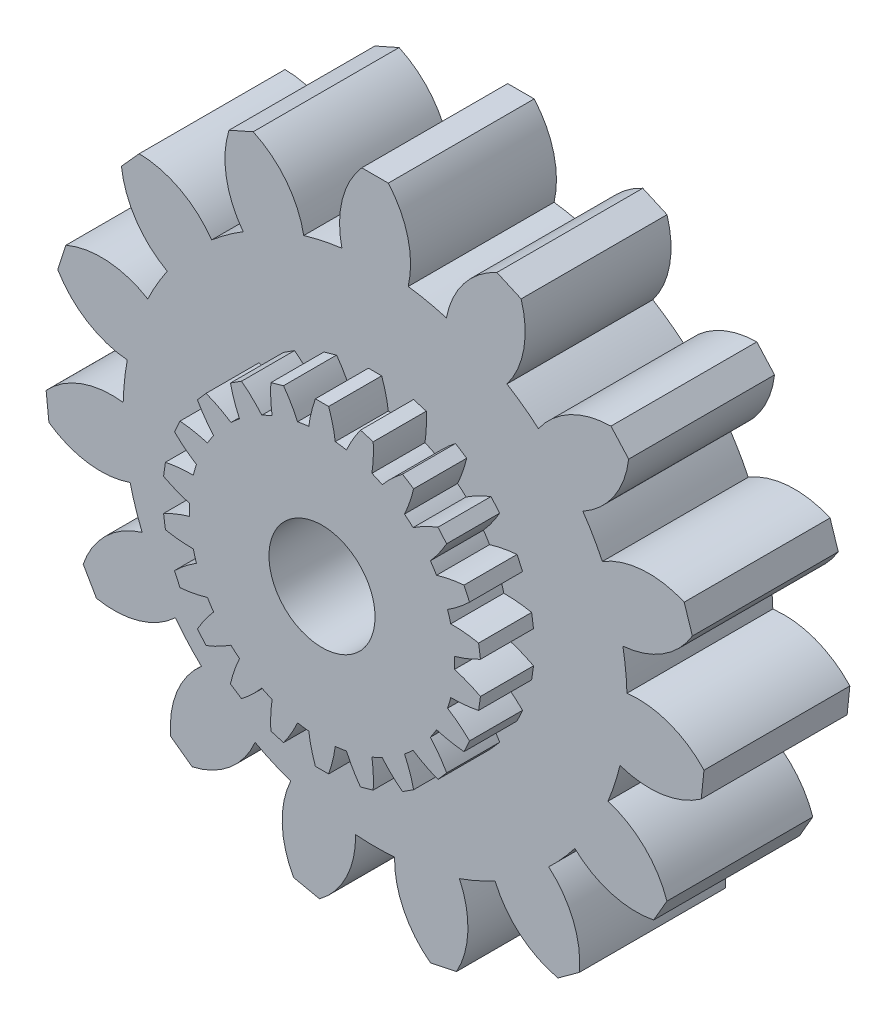
from build123d import *

# Parameters (mm, degrees)
SKETCH_2_R          = 9.5
EXTRUDE_1_DEPTH     = 5.5
EXTRUDE_START       = -5.5
EXTRUDE_2_DEPTH     = 5.5
SKETCH_4_R          = 5
EXTRUDE_3_DEPTH     = 2
EXTRUDE_4_REACH     = 21.085
SKETCH_6_R          = 2
CUT_EXTRUDE_1_DEPTH = 20.085143718
CUT_EXTRUDE_START   = -7.5
CUT_EXTRUDE_2_DEPTH = 2
SKETCH_8_R          = 5
CUT_EXTRUDE_3_DEPTH = 2


with BuildPart() as part:
    # 草图2 → 凸台-拉伸1 (new body)
    with BuildSketch(Plane.XY):
        Circle(SKETCH_2_R)
    extrude(amount=EXTRUDE_1_DEPTH)

    # 草图3 → 凸台-拉伸2 (add)
    with BuildSketch(Plane.XY.offset(5.5).offset(EXTRUDE_START)):
        with BuildLine():
            Line((5.507385989, 11.140494791), (4.593840531, 11.547231434))
            ThreePointArc((4.593840531, 11.547231434), (3.346426162, 10.560008077), (2.688471508, 9.111647543))
            ThreePointArc((2.688471508, 9.111647543), (3.863998109, 8.678681848), (4.972335153, 8.094805935))
            ThreePointArc((4.972335153, 8.094805935), (5.608419193, 9.552903894), (5.507385989, 11.140494791))
        make_face()
        with BuildLine():
            Line((0.5, 12.417404101), (-0.5, 12.417404101))
            ThreePointArc((-0.5, 12.417404101), (-1.238029817, 11.008161555), (-1.25, 9.417404101))
            ThreePointArc((-1.25, 9.417404101), (0, 9.5), (1.25, 9.417404101))
            ThreePointArc((1.25, 9.417404101), (1.238029817, 11.008161555), (0.5, 12.417404101))
        make_face()
        with BuildLine():
            Line((9.562494907, 7.937292723), (8.8933643, 8.680437548))
            ThreePointArc((8.8933643, 8.680437548), (7.352254656, 8.285933268), (6.162081869, 7.230404348))
            ThreePointArc((6.162081869, 7.230404348), (7.059875842, 6.35674076), (7.834908385, 5.372542285))
            ThreePointArc((7.834908385, 5.372542285), (9.00906194, 6.445862364), (9.562494907, 7.937292723))
        make_face()
        with BuildLine():
            Line((11.964161583, 3.361660635), (11.655144588, 4.312717151))
            ThreePointArc((11.655144588, 4.312717151), (10.086811526, 4.579145322), (8.570212294, 4.098958555))
            ThreePointArc((8.570212294, 4.098958555), (9.035036905, 2.935661447), (9.34275478, 1.721317265))
            ThreePointArc((9.34275478, 1.721317265), (10.851956032, 2.224272673), (11.964161583, 3.361660635))
        make_face()
        with BuildLine():
            Line((12.29711603, -1.795233116), (12.401644494, -0.800711221))
            ThreePointArc((12.401644494, -0.800711221), (11.077267049, 0.080581549), (9.496475155, 0.258765591))
            ThreePointArc((9.496475155, 0.258765591), (9.447958006, -0.993020401), (9.235153997, -2.227539148))
            ThreePointArc((9.235153997, -2.227539148), (10.81844834, -2.381913971), (12.29711603, -1.795233116))
        make_face()
        with BuildLine():
            Line((10.5037874, -6.641714752), (11.0037874, -5.775689349))
            ThreePointArc((11.0037874, -5.775689349), (10.152362464, -4.431915506), (8.780711189, -3.626170296))
            ThreePointArc((8.780711189, -3.626170296), (8.227241336, -4.75), (7.530711189, -5.791233805))
            ThreePointArc((7.530711189, -5.791233805), (8.914332647, -6.576246049), (10.5037874, -6.641714752))
        make_face()
        with BuildLine():
            Line((6.894258505, -10.33978357), (7.703275499, -9.751998318))
            ThreePointArc((7.703275499, -9.751998318), (7.472022178, -8.178094107), (6.546682488, -6.884108395))
            ThreePointArc((6.546682488, -6.884108395), (5.583959897, -7.685661447), (4.524140002, -8.353571526))
            ThreePointArc((4.524140002, -8.353571526), (5.468847856, -9.633485443), (6.894258505, -10.33978357))
        make_face()
        with BuildLine():
            Line((2.092649682, -12.250009874), (3.070797283, -12.042098183))
            ThreePointArc((3.070797283, -12.042098183), (3.499701377, -10.510205941), (3.180672911, -8.951721613))
            ThreePointArc((3.180672911, -8.951721613), (1.975161063, -9.292402207), (0.735303909, -9.47150084))
            ThreePointArc((0.735303909, -9.47150084), (1.077749587, -11.025007686), (2.092649682, -12.250009874))
        make_face()
        with BuildLine():
            Line((-3.070797283, -12.042098183), (-2.092649682, -12.250009874))
            ThreePointArc((-2.092649682, -12.250009874), (-1.077749587, -11.025007686), (-0.735303909, -9.47150084))
            ThreePointArc((-0.735303909, -9.47150084), (-1.975161063, -9.292402207), (-3.180672911, -8.951721613))
            ThreePointArc((-3.180672911, -8.951721613), (-3.499701377, -10.510205941), (-3.070797283, -12.042098183))
        make_face()
        with BuildLine():
            Line((-7.703275499, -9.751998318), (-6.894258505, -10.33978357))
            ThreePointArc((-6.894258505, -10.33978357), (-5.468847856, -9.633485443), (-4.524140002, -8.353571526))
            ThreePointArc((-4.524140002, -8.353571526), (-5.583959897, -7.685661447), (-6.546682488, -6.884108395))
            ThreePointArc((-6.546682488, -6.884108395), (-7.472022178, -8.178094107), (-7.703275499, -9.751998318))
        make_face()
        with BuildLine():
            Line((-11.0037874, -5.775689349), (-10.5037874, -6.641714752))
            ThreePointArc((-10.5037874, -6.641714752), (-8.914332647, -6.576246049), (-7.530711189, -5.791233805))
            ThreePointArc((-7.530711189, -5.791233805), (-8.227241336, -4.75), (-8.780711189, -3.626170296))
            ThreePointArc((-8.780711189, -3.626170296), (-10.152362464, -4.431915506), (-11.0037874, -5.775689349))
        make_face()
        with BuildLine():
            Line((-12.401644494, -0.800711221), (-12.29711603, -1.795233116))
            ThreePointArc((-12.29711603, -1.795233116), (-10.81844834, -2.381913971), (-9.235153997, -2.227539148))
            ThreePointArc((-9.235153997, -2.227539148), (-9.447958006, -0.993020401), (-9.496475155, 0.258765591))
            ThreePointArc((-9.496475155, 0.258765591), (-11.077267049, 0.080581549), (-12.401644494, -0.800711221))
        make_face()
        with BuildLine():
            Line((-11.655144588, 4.312717151), (-11.964161583, 3.361660635))
            ThreePointArc((-11.964161583, 3.361660635), (-10.851956032, 2.224272673), (-9.34275478, 1.721317265))
            ThreePointArc((-9.34275478, 1.721317265), (-9.035036905, 2.935661447), (-8.570212294, 4.098958555))
            ThreePointArc((-8.570212294, 4.098958555), (-10.086811526, 4.579145322), (-11.655144588, 4.312717151))
        make_face()
        with BuildLine():
            Line((-8.8933643, 8.680437548), (-9.562494907, 7.937292723))
            ThreePointArc((-9.562494907, 7.937292723), (-9.00906194, 6.445862364), (-7.834908385, 5.372542285))
            ThreePointArc((-7.834908385, 5.372542285), (-7.059875842, 6.35674076), (-6.162081869, 7.230404348))
            ThreePointArc((-6.162081869, 7.230404348), (-7.352254656, 8.285933268), (-8.8933643, 8.680437548))
        make_face()
        with BuildLine():
            Line((-4.593840531, 11.547231434), (-5.507385989, 11.140494791))
            ThreePointArc((-5.507385989, 11.140494791), (-5.608419193, 9.552903894), (-4.972335153, 8.094805935))
            ThreePointArc((-4.972335153, 8.094805935), (-3.863998109, 8.678681848), (-2.688471508, 9.111647543))
            ThreePointArc((-2.688471508, 9.111647543), (-3.346426162, 10.560008077), (-4.593840531, 11.547231434))
        make_face()
    extrude(amount=EXTRUDE_2_DEPTH)

    # 草图4 → 凸台-拉伸3 (add)
    with BuildSketch(Plane.XY.offset(5.5)):
        Circle(SKETCH_4_R)
    extrude(amount=EXTRUDE_3_DEPTH)

    # 草图5 → 凸台-拉伸4 (add, up to next)
    with BuildSketch(Plane.XY.offset(7.5), mode=Mode.PRIVATE) as extrude_4_sk1:
        with BuildLine():
            Line((1.930268584, 5.686524702), (1.450522098, 5.827390981))
            ThreePointArc((1.450522098, 5.827390981), (1.16259648, 5.384496579), (0.921855287, 4.914283552))
            ThreePointArc((0.921855287, 4.914283552), (1.408662784, 4.797464868), (1.88134826, 4.632550995))
            ThreePointArc((1.88134826, 4.632550995), (1.933040236, 5.158273881), (1.930268584, 5.686524702))
        make_face()
    extrude_4_tool1 = extrude(extrude_4_sk1.sketch, amount=-EXTRUDE_4_REACH, mode=Mode.PRIVATE) - part.part
    # 草图5 → 凸台-拉伸4 (add, up to next)
    with BuildSketch(Plane.XY.offset(7.5), mode=Mode.PRIVATE) as extrude_4_sk2:
        with BuildLine():
            Line((3.454158288, 4.912360993), (3.033531522, 5.182681401))
            ThreePointArc((3.033531522, 5.182681401), (2.632491142, 4.838845355), (2.26902734, 4.455503892))
            ThreePointArc((2.26902734, 4.455503892), (2.703204087, 4.206267664), (3.110280873, 3.914863074))
            ThreePointArc((3.110280873, 3.914863074), (3.307992214, 4.404727176), (3.454158288, 4.912360993))
        make_face()
    extrude_4_tool2 = extrude(extrude_4_sk2.sketch, amount=-EXTRUDE_4_REACH, mode=Mode.PRIVATE) - part.part
    # 草图5 → 凸台-拉伸4 (add, up to next)
    with BuildSketch(Plane.XY.offset(7.5), mode=Mode.PRIVATE) as extrude_4_sk3:
        with BuildLine():
            Line((0.25, 6), (-0.25, 6))
            ThreePointArc((-0.25, 6), (-0.401484835, 5.493927913), (-0.5, 4.974937186))
            ThreePointArc((-0.5, 4.974937186), (0, 5), (0.5, 4.974937186))
            ThreePointArc((0.5, 4.974937186), (0.401484835, 5.493927913), (0.25, 6))
        make_face()
    extrude_4_tool3 = extrude(extrude_4_sk3.sketch, amount=-EXTRUDE_4_REACH, mode=Mode.PRIVATE) - part.part
    # 草图5 → 凸台-拉伸4 (add, up to next)
    with BuildSketch(Plane.XY.offset(7.5), mode=Mode.PRIVATE) as extrude_4_sk4:
        with BuildLine():
            Line((4.69821263, 3.74022701), (4.370782263, 4.118101797))
            ThreePointArc((4.370782263, 4.118101797), (3.889117028, 3.901179659), (3.432376293, 3.635765804))
            ThreePointArc((3.432376293, 3.635765804), (3.778747872, 3.27430367), (4.087237027, 2.880016229))
            ThreePointArc((4.087237027, 2.880016229), (4.414950336, 3.294335672), (4.69821263, 3.74022701))
        make_face()
    extrude_4_tool4 = extrude(extrude_4_sk4.sketch, amount=-EXTRUDE_4_REACH, mode=Mode.PRIVATE) - part.part
    # 草图5 → 凸台-拉伸4 (add, up to next)
    with BuildSketch(Plane.XY.offset(7.5), mode=Mode.PRIVATE) as extrude_4_sk5:
        with BuildLine():
            Line((5.561645725, 2.265082079), (5.353938219, 2.719898077))
            ThreePointArc((5.353938219, 2.719898077), (4.830669782, 2.647463587), (4.317654532, 2.521479593))
            ThreePointArc((4.317654532, 2.521479593), (4.548159977, 2.077075065), (4.733069545, 1.611847598))
            ThreePointArc((4.733069545, 1.611847598), (5.164235438, 1.917056684), (5.561645725, 2.265082079))
        make_face()
    extrude_4_tool5 = extrude(extrude_4_sk5.sketch, amount=-EXTRUDE_4_REACH, mode=Mode.PRIVATE) - part.part
    # 草图5 → 凸台-拉伸4 (add, up to next)
    with BuildSketch(Plane.XY.offset(7.5), mode=Mode.PRIVATE) as extrude_4_sk6:
        with BuildLine():
            Line((5.974507361, 0.606433669), (5.903349942, 1.10134439))
            ThreePointArc((5.903349942, 1.10134439), (5.380870399, 1.179265761), (4.853142079, 1.202918102))
            ThreePointArc((4.853142079, 1.202918102), (4.949107209, 0.711574191), (4.995456917, 0.21309666))
            ThreePointArc((4.995456917, 0.21309666), (5.495144898, 0.384469164), (5.974507361, 0.606433669))
        make_face()
    extrude_4_tool6 = extrude(extrude_4_sk6.sketch, amount=-EXTRUDE_4_REACH, mode=Mode.PRIVATE) - part.part
    # 草图5 → 凸台-拉伸4 (add, up to next)
    with BuildSketch(Plane.XY.offset(7.5), mode=Mode.PRIVATE) as extrude_4_sk7:
        with BuildLine():
            Line((5.903349942, -1.10134439), (5.974507361, -0.606433669))
            ThreePointArc((5.974507361, -0.606433669), (5.495144898, -0.384469164), (4.995456917, -0.21309666))
            ThreePointArc((4.995456917, -0.21309666), (4.949107209, -0.711574191), (4.853142079, -1.202918102))
            ThreePointArc((4.853142079, -1.202918102), (5.380870399, -1.179265761), (5.903349942, -1.10134439))
        make_face()
    extrude_4_tool7 = extrude(extrude_4_sk7.sketch, amount=-EXTRUDE_4_REACH, mode=Mode.PRIVATE) - part.part
    # 草图5 → 凸台-拉伸4 (add, up to next)
    with BuildSketch(Plane.XY.offset(7.5), mode=Mode.PRIVATE) as extrude_4_sk8:
        with BuildLine():
            Line((5.353938219, -2.719898077), (5.561645725, -2.265082079))
            ThreePointArc((5.561645725, -2.265082079), (5.164235438, -1.917056684), (4.733069545, -1.611847598))
            ThreePointArc((4.733069545, -1.611847598), (4.548159977, -2.077075065), (4.317654532, -2.521479593))
            ThreePointArc((4.317654532, -2.521479593), (4.830669782, -2.647463587), (5.353938219, -2.719898077))
        make_face()
    extrude_4_tool8 = extrude(extrude_4_sk8.sketch, amount=-EXTRUDE_4_REACH, mode=Mode.PRIVATE) - part.part
    # 草图5 → 凸台-拉伸4 (add, up to next)
    with BuildSketch(Plane.XY.offset(7.5), mode=Mode.PRIVATE) as extrude_4_sk9:
        with BuildLine():
            Line((4.370782263, -4.118101797), (4.69821263, -3.74022701))
            ThreePointArc((4.69821263, -3.74022701), (4.414950336, -3.294335672), (4.087237027, -2.880016229))
            ThreePointArc((4.087237027, -2.880016229), (3.778747872, -3.27430367), (3.432376293, -3.635765804))
            ThreePointArc((3.432376293, -3.635765804), (3.889117028, -3.901179659), (4.370782263, -4.118101797))
        make_face()
    extrude_4_tool9 = extrude(extrude_4_sk9.sketch, amount=-EXTRUDE_4_REACH, mode=Mode.PRIVATE) - part.part
    # 草图5 → 凸台-拉伸4 (add, up to next)
    with BuildSketch(Plane.XY.offset(7.5), mode=Mode.PRIVATE) as extrude_4_sk10:
        with BuildLine():
            Line((3.033531522, -5.182681401), (3.454158288, -4.912360993))
            ThreePointArc((3.454158288, -4.912360993), (3.307992214, -4.404727176), (3.110280873, -3.914863074))
            ThreePointArc((3.110280873, -3.914863074), (2.703204087, -4.206267664), (2.26902734, -4.455503892))
            ThreePointArc((2.26902734, -4.455503892), (2.632491142, -4.838845355), (3.033531522, -5.182681401))
        make_face()
    extrude_4_tool10 = extrude(extrude_4_sk10.sketch, amount=-EXTRUDE_4_REACH, mode=Mode.PRIVATE) - part.part
    # 草图5 → 凸台-拉伸4 (add, up to next)
    with BuildSketch(Plane.XY.offset(7.5), mode=Mode.PRIVATE) as extrude_4_sk11:
        with BuildLine():
            Line((1.450522098, -5.827390981), (1.930268584, -5.686524702))
            ThreePointArc((1.930268584, -5.686524702), (1.933040236, -5.158273881), (1.88134826, -4.632550995))
            ThreePointArc((1.88134826, -4.632550995), (1.408662784, -4.797464868), (0.921855287, -4.914283552))
            ThreePointArc((0.921855287, -4.914283552), (1.16259648, -5.384496579), (1.450522098, -5.827390981))
        make_face()
    extrude_4_tool11 = extrude(extrude_4_sk11.sketch, amount=-EXTRUDE_4_REACH, mode=Mode.PRIVATE) - part.part
    # 草图5 → 凸台-拉伸4 (add, up to next)
    with BuildSketch(Plane.XY.offset(7.5), mode=Mode.PRIVATE) as extrude_4_sk12:
        with BuildLine():
            Line((-0.25, -6), (0.25, -6))
            ThreePointArc((0.25, -6), (0.401484835, -5.493927913), (0.5, -4.974937186))
            ThreePointArc((0.5, -4.974937186), (0, -5), (-0.5, -4.974937186))
            ThreePointArc((-0.5, -4.974937186), (-0.401484835, -5.493927913), (-0.25, -6))
        make_face()
    extrude_4_tool12 = extrude(extrude_4_sk12.sketch, amount=-EXTRUDE_4_REACH, mode=Mode.PRIVATE) - part.part
    # 草图5 → 凸台-拉伸4 (add, up to next)
    with BuildSketch(Plane.XY.offset(7.5), mode=Mode.PRIVATE) as extrude_4_sk13:
        with BuildLine():
            Line((-1.930268584, -5.686524702), (-1.450522098, -5.827390981))
            ThreePointArc((-1.450522098, -5.827390981), (-1.16259648, -5.384496579), (-0.921855287, -4.914283552))
            ThreePointArc((-0.921855287, -4.914283552), (-1.408662784, -4.797464868), (-1.88134826, -4.632550995))
            ThreePointArc((-1.88134826, -4.632550995), (-1.933040236, -5.158273881), (-1.930268584, -5.686524702))
        make_face()
    extrude_4_tool13 = extrude(extrude_4_sk13.sketch, amount=-EXTRUDE_4_REACH, mode=Mode.PRIVATE) - part.part
    # 草图5 → 凸台-拉伸4 (add, up to next)
    with BuildSketch(Plane.XY.offset(7.5), mode=Mode.PRIVATE) as extrude_4_sk14:
        with BuildLine():
            Line((-3.454158288, -4.912360993), (-3.033531522, -5.182681401))
            ThreePointArc((-3.033531522, -5.182681401), (-2.632491142, -4.838845355), (-2.26902734, -4.455503892))
            ThreePointArc((-2.26902734, -4.455503892), (-2.703204087, -4.206267664), (-3.110280873, -3.914863074))
            ThreePointArc((-3.110280873, -3.914863074), (-3.307992214, -4.404727176), (-3.454158288, -4.912360993))
        make_face()
    extrude_4_tool14 = extrude(extrude_4_sk14.sketch, amount=-EXTRUDE_4_REACH, mode=Mode.PRIVATE) - part.part
    # 草图5 → 凸台-拉伸4 (add, up to next)
    with BuildSketch(Plane.XY.offset(7.5), mode=Mode.PRIVATE) as extrude_4_sk15:
        with BuildLine():
            Line((-4.69821263, -3.74022701), (-4.370782263, -4.118101797))
            ThreePointArc((-4.370782263, -4.118101797), (-3.889117028, -3.901179659), (-3.432376293, -3.635765804))
            ThreePointArc((-3.432376293, -3.635765804), (-3.778747872, -3.27430367), (-4.087237027, -2.880016229))
            ThreePointArc((-4.087237027, -2.880016229), (-4.414950336, -3.294335672), (-4.69821263, -3.74022701))
        make_face()
    extrude_4_tool15 = extrude(extrude_4_sk15.sketch, amount=-EXTRUDE_4_REACH, mode=Mode.PRIVATE) - part.part
    # 草图5 → 凸台-拉伸4 (add, up to next)
    with BuildSketch(Plane.XY.offset(7.5), mode=Mode.PRIVATE) as extrude_4_sk16:
        with BuildLine():
            Line((-5.561645725, -2.265082079), (-5.353938219, -2.719898077))
            ThreePointArc((-5.353938219, -2.719898077), (-4.830669782, -2.647463587), (-4.317654532, -2.521479593))
            ThreePointArc((-4.317654532, -2.521479593), (-4.548159977, -2.077075065), (-4.733069545, -1.611847598))
            ThreePointArc((-4.733069545, -1.611847598), (-5.164235438, -1.917056684), (-5.561645725, -2.265082079))
        make_face()
    extrude_4_tool16 = extrude(extrude_4_sk16.sketch, amount=-EXTRUDE_4_REACH, mode=Mode.PRIVATE) - part.part
    # 草图5 → 凸台-拉伸4 (add, up to next)
    with BuildSketch(Plane.XY.offset(7.5), mode=Mode.PRIVATE) as extrude_4_sk17:
        with BuildLine():
            Line((-5.974507361, -0.606433669), (-5.903349942, -1.10134439))
            ThreePointArc((-5.903349942, -1.10134439), (-5.380870399, -1.179265761), (-4.853142079, -1.202918102))
            ThreePointArc((-4.853142079, -1.202918102), (-4.949107209, -0.711574191), (-4.995456917, -0.21309666))
            ThreePointArc((-4.995456917, -0.21309666), (-5.495144898, -0.384469164), (-5.974507361, -0.606433669))
        make_face()
    extrude_4_tool17 = extrude(extrude_4_sk17.sketch, amount=-EXTRUDE_4_REACH, mode=Mode.PRIVATE) - part.part
    # 草图5 → 凸台-拉伸4 (add, up to next)
    with BuildSketch(Plane.XY.offset(7.5), mode=Mode.PRIVATE) as extrude_4_sk18:
        with BuildLine():
            Line((-5.903349942, 1.10134439), (-5.974507361, 0.606433669))
            ThreePointArc((-5.974507361, 0.606433669), (-5.495144898, 0.384469164), (-4.995456917, 0.21309666))
            ThreePointArc((-4.995456917, 0.21309666), (-4.949107209, 0.711574191), (-4.853142079, 1.202918102))
            ThreePointArc((-4.853142079, 1.202918102), (-5.380870399, 1.179265761), (-5.903349942, 1.10134439))
        make_face()
    extrude_4_tool18 = extrude(extrude_4_sk18.sketch, amount=-EXTRUDE_4_REACH, mode=Mode.PRIVATE) - part.part
    # 草图5 → 凸台-拉伸4 (add, up to next)
    with BuildSketch(Plane.XY.offset(7.5), mode=Mode.PRIVATE) as extrude_4_sk19:
        with BuildLine():
            Line((-5.353938219, 2.719898077), (-5.561645725, 2.265082079))
            ThreePointArc((-5.561645725, 2.265082079), (-5.164235438, 1.917056684), (-4.733069545, 1.611847598))
            ThreePointArc((-4.733069545, 1.611847598), (-4.548159977, 2.077075065), (-4.317654532, 2.521479593))
            ThreePointArc((-4.317654532, 2.521479593), (-4.830669782, 2.647463587), (-5.353938219, 2.719898077))
        make_face()
    extrude_4_tool19 = extrude(extrude_4_sk19.sketch, amount=-EXTRUDE_4_REACH, mode=Mode.PRIVATE) - part.part
    # 草图5 → 凸台-拉伸4 (add, up to next)
    with BuildSketch(Plane.XY.offset(7.5), mode=Mode.PRIVATE) as extrude_4_sk20:
        with BuildLine():
            Line((-4.370782263, 4.118101797), (-4.69821263, 3.74022701))
            ThreePointArc((-4.69821263, 3.74022701), (-4.414950336, 3.294335672), (-4.087237027, 2.880016229))
            ThreePointArc((-4.087237027, 2.880016229), (-3.778747872, 3.27430367), (-3.432376293, 3.635765804))
            ThreePointArc((-3.432376293, 3.635765804), (-3.889117028, 3.901179659), (-4.370782263, 4.118101797))
        make_face()
    extrude_4_tool20 = extrude(extrude_4_sk20.sketch, amount=-EXTRUDE_4_REACH, mode=Mode.PRIVATE) - part.part
    # 草图5 → 凸台-拉伸4 (add, up to next)
    with BuildSketch(Plane.XY.offset(7.5), mode=Mode.PRIVATE) as extrude_4_sk21:
        with BuildLine():
            Line((-3.033531522, 5.182681401), (-3.454158288, 4.912360993))
            ThreePointArc((-3.454158288, 4.912360993), (-3.307992214, 4.404727176), (-3.110280873, 3.914863074))
            ThreePointArc((-3.110280873, 3.914863074), (-2.703204087, 4.206267664), (-2.26902734, 4.455503892))
            ThreePointArc((-2.26902734, 4.455503892), (-2.632491142, 4.838845355), (-3.033531522, 5.182681401))
        make_face()
    extrude_4_tool21 = extrude(extrude_4_sk21.sketch, amount=-EXTRUDE_4_REACH, mode=Mode.PRIVATE) - part.part
    # 草图5 → 凸台-拉伸4 (add, up to next)
    with BuildSketch(Plane.XY.offset(7.5), mode=Mode.PRIVATE) as extrude_4_sk22:
        with BuildLine():
            Line((-1.450522098, 5.827390981), (-1.930268584, 5.686524702))
            ThreePointArc((-1.930268584, 5.686524702), (-1.933040236, 5.158273881), (-1.88134826, 4.632550995))
            ThreePointArc((-1.88134826, 4.632550995), (-1.408662784, 4.797464868), (-0.921855287, 4.914283552))
            ThreePointArc((-0.921855287, 4.914283552), (-1.16259648, 5.384496579), (-1.450522098, 5.827390981))
        make_face()
    extrude_4_tool22 = extrude(extrude_4_sk22.sketch, amount=-EXTRUDE_4_REACH, mode=Mode.PRIVATE) - part.part
    add(extrude_4_tool1.solids().sort_by_distance((1.533423, 5.22236, 7.5))[0])
    add(extrude_4_tool2.solids().sort_by_distance((2.942618, 4.578803, 7.5))[0])
    add(extrude_4_tool3.solids().sort_by_distance((0, 5.442833, 7.5))[0])
    add(extrude_4_tool4.solids().sort_by_distance((4.113419, 3.564298, 7.5))[0])
    add(extrude_4_tool5.solids().sort_by_distance((4.950975, 2.261035, 7.5))[0])
    add(extrude_4_tool6.solids().sort_by_distance((5.387433, 0.774596, 7.5))[0])
    add(extrude_4_tool7.solids().sort_by_distance((5.387433, -0.774596, 7.5))[0])
    add(extrude_4_tool8.solids().sort_by_distance((4.950975, -2.261035, 7.5))[0])
    add(extrude_4_tool9.solids().sort_by_distance((4.113419, -3.564298, 7.5))[0])
    add(extrude_4_tool10.solids().sort_by_distance((2.942618, -4.578803, 7.5))[0])
    add(extrude_4_tool11.solids().sort_by_distance((1.533423, -5.22236, 7.5))[0])
    add(extrude_4_tool12.solids().sort_by_distance((0, -5.442833, 7.5))[0])
    add(extrude_4_tool13.solids().sort_by_distance((-1.533423, -5.22236, 7.5))[0])
    add(extrude_4_tool14.solids().sort_by_distance((-2.942618, -4.578803, 7.5))[0])
    add(extrude_4_tool15.solids().sort_by_distance((-4.113419, -3.564298, 7.5))[0])
    add(extrude_4_tool16.solids().sort_by_distance((-4.950975, -2.261035, 7.5))[0])
    add(extrude_4_tool17.solids().sort_by_distance((-5.387433, -0.774596, 7.5))[0])
    add(extrude_4_tool18.solids().sort_by_distance((-5.387433, 0.774596, 7.5))[0])
    add(extrude_4_tool19.solids().sort_by_distance((-4.950975, 2.261035, 7.5))[0])
    add(extrude_4_tool20.solids().sort_by_distance((-4.113419, 3.564298, 7.5))[0])
    add(extrude_4_tool21.solids().sort_by_distance((-2.942618, 4.578803, 7.5))[0])
    add(extrude_4_tool22.solids().sort_by_distance((-1.533423, 5.22236, 7.5))[0])

    # 草图6 → 切除-拉伸1 (cut, through all)
    with BuildSketch(Plane.XY.offset(7.5)):
        Circle(SKETCH_6_R)
    extrude(amount=-CUT_EXTRUDE_1_DEPTH, mode=Mode.SUBTRACT)

    # 草图5<2> → 切除-拉伸2 (cut)
    with BuildSketch(Plane.XY.offset(7.5).offset(CUT_EXTRUDE_START)):
        with BuildLine():
            Line((1.930268584, 5.686524702), (1.450522098, 5.827390981))
            ThreePointArc((1.450522098, 5.827390981), (1.16259648, 5.384496579), (0.921855287, 4.914283552))
            ThreePointArc((0.921855287, 4.914283552), (1.408662784, 4.797464868), (1.88134826, 4.632550995))
            ThreePointArc((1.88134826, 4.632550995), (1.933040236, 5.158273881), (1.930268584, 5.686524702))
        make_face()
        with BuildLine():
            Line((3.454158288, 4.912360993), (3.033531522, 5.182681401))
            ThreePointArc((3.033531522, 5.182681401), (2.632491142, 4.838845355), (2.26902734, 4.455503892))
            ThreePointArc((2.26902734, 4.455503892), (2.703204087, 4.206267664), (3.110280873, 3.914863074))
            ThreePointArc((3.110280873, 3.914863074), (3.307992214, 4.404727176), (3.454158288, 4.912360993))
        make_face()
        with BuildLine():
            Line((0.25, 6), (-0.25, 6))
            ThreePointArc((-0.25, 6), (-0.401484835, 5.493927913), (-0.5, 4.974937186))
            ThreePointArc((-0.5, 4.974937186), (0, 5), (0.5, 4.974937186))
            ThreePointArc((0.5, 4.974937186), (0.401484835, 5.493927913), (0.25, 6))
        make_face()
        with BuildLine():
            Line((4.69821263, 3.74022701), (4.370782263, 4.118101797))
            ThreePointArc((4.370782263, 4.118101797), (3.889117028, 3.901179659), (3.432376293, 3.635765804))
            ThreePointArc((3.432376293, 3.635765804), (3.778747872, 3.27430367), (4.087237027, 2.880016229))
            ThreePointArc((4.087237027, 2.880016229), (4.414950336, 3.294335672), (4.69821263, 3.74022701))
        make_face()
        with BuildLine():
            Line((5.561645725, 2.265082079), (5.353938219, 2.719898077))
            ThreePointArc((5.353938219, 2.719898077), (4.830669782, 2.647463587), (4.317654532, 2.521479593))
            ThreePointArc((4.317654532, 2.521479593), (4.548159977, 2.077075065), (4.733069545, 1.611847598))
            ThreePointArc((4.733069545, 1.611847598), (5.164235438, 1.917056684), (5.561645725, 2.265082079))
        make_face()
        with BuildLine():
            Line((5.974507361, 0.606433669), (5.903349942, 1.10134439))
            ThreePointArc((5.903349942, 1.10134439), (5.380870399, 1.179265761), (4.853142079, 1.202918102))
            ThreePointArc((4.853142079, 1.202918102), (4.949107209, 0.711574191), (4.995456917, 0.21309666))
            ThreePointArc((4.995456917, 0.21309666), (5.495144898, 0.384469164), (5.974507361, 0.606433669))
        make_face()
        with BuildLine():
            Line((5.903349942, -1.10134439), (5.974507361, -0.606433669))
            ThreePointArc((5.974507361, -0.606433669), (5.495144898, -0.384469164), (4.995456917, -0.21309666))
            ThreePointArc((4.995456917, -0.21309666), (4.949107209, -0.711574191), (4.853142079, -1.202918102))
            ThreePointArc((4.853142079, -1.202918102), (5.380870399, -1.179265761), (5.903349942, -1.10134439))
        make_face()
        with BuildLine():
            Line((5.353938219, -2.719898077), (5.561645725, -2.265082079))
            ThreePointArc((5.561645725, -2.265082079), (5.164235438, -1.917056684), (4.733069545, -1.611847598))
            ThreePointArc((4.733069545, -1.611847598), (4.548159977, -2.077075065), (4.317654532, -2.521479593))
            ThreePointArc((4.317654532, -2.521479593), (4.830669782, -2.647463587), (5.353938219, -2.719898077))
        make_face()
        with BuildLine():
            Line((4.370782263, -4.118101797), (4.69821263, -3.74022701))
            ThreePointArc((4.69821263, -3.74022701), (4.414950336, -3.294335672), (4.087237027, -2.880016229))
            ThreePointArc((4.087237027, -2.880016229), (3.778747872, -3.27430367), (3.432376293, -3.635765804))
            ThreePointArc((3.432376293, -3.635765804), (3.889117028, -3.901179659), (4.370782263, -4.118101797))
        make_face()
        with BuildLine():
            Line((3.033531522, -5.182681401), (3.454158288, -4.912360993))
            ThreePointArc((3.454158288, -4.912360993), (3.307992214, -4.404727176), (3.110280873, -3.914863074))
            ThreePointArc((3.110280873, -3.914863074), (2.703204087, -4.206267664), (2.26902734, -4.455503892))
            ThreePointArc((2.26902734, -4.455503892), (2.632491142, -4.838845355), (3.033531522, -5.182681401))
        make_face()
        with BuildLine():
            Line((1.450522098, -5.827390981), (1.930268584, -5.686524702))
            ThreePointArc((1.930268584, -5.686524702), (1.933040236, -5.158273881), (1.88134826, -4.632550995))
            ThreePointArc((1.88134826, -4.632550995), (1.408662784, -4.797464868), (0.921855287, -4.914283552))
            ThreePointArc((0.921855287, -4.914283552), (1.16259648, -5.384496579), (1.450522098, -5.827390981))
        make_face()
        with BuildLine():
            Line((-0.25, -6), (0.25, -6))
            ThreePointArc((0.25, -6), (0.401484835, -5.493927913), (0.5, -4.974937186))
            ThreePointArc((0.5, -4.974937186), (0, -5), (-0.5, -4.974937186))
            ThreePointArc((-0.5, -4.974937186), (-0.401484835, -5.493927913), (-0.25, -6))
        make_face()
        with BuildLine():
            Line((-1.930268584, -5.686524702), (-1.450522098, -5.827390981))
            ThreePointArc((-1.450522098, -5.827390981), (-1.16259648, -5.384496579), (-0.921855287, -4.914283552))
            ThreePointArc((-0.921855287, -4.914283552), (-1.408662784, -4.797464868), (-1.88134826, -4.632550995))
            ThreePointArc((-1.88134826, -4.632550995), (-1.933040236, -5.158273881), (-1.930268584, -5.686524702))
        make_face()
        with BuildLine():
            Line((-3.454158288, -4.912360993), (-3.033531522, -5.182681401))
            ThreePointArc((-3.033531522, -5.182681401), (-2.632491142, -4.838845355), (-2.26902734, -4.455503892))
            ThreePointArc((-2.26902734, -4.455503892), (-2.703204087, -4.206267664), (-3.110280873, -3.914863074))
            ThreePointArc((-3.110280873, -3.914863074), (-3.307992214, -4.404727176), (-3.454158288, -4.912360993))
        make_face()
        with BuildLine():
            Line((-4.69821263, -3.74022701), (-4.370782263, -4.118101797))
            ThreePointArc((-4.370782263, -4.118101797), (-3.889117028, -3.901179659), (-3.432376293, -3.635765804))
            ThreePointArc((-3.432376293, -3.635765804), (-3.778747872, -3.27430367), (-4.087237027, -2.880016229))
            ThreePointArc((-4.087237027, -2.880016229), (-4.414950336, -3.294335672), (-4.69821263, -3.74022701))
        make_face()
        with BuildLine():
            Line((-5.561645725, -2.265082079), (-5.353938219, -2.719898077))
            ThreePointArc((-5.353938219, -2.719898077), (-4.830669782, -2.647463587), (-4.317654532, -2.521479593))
            ThreePointArc((-4.317654532, -2.521479593), (-4.548159977, -2.077075065), (-4.733069545, -1.611847598))
            ThreePointArc((-4.733069545, -1.611847598), (-5.164235438, -1.917056684), (-5.561645725, -2.265082079))
        make_face()
        with BuildLine():
            Line((-5.974507361, -0.606433669), (-5.903349942, -1.10134439))
            ThreePointArc((-5.903349942, -1.10134439), (-5.380870399, -1.179265761), (-4.853142079, -1.202918102))
            ThreePointArc((-4.853142079, -1.202918102), (-4.949107209, -0.711574191), (-4.995456917, -0.21309666))
            ThreePointArc((-4.995456917, -0.21309666), (-5.495144898, -0.384469164), (-5.974507361, -0.606433669))
        make_face()
        with BuildLine():
            Line((-5.903349942, 1.10134439), (-5.974507361, 0.606433669))
            ThreePointArc((-5.974507361, 0.606433669), (-5.495144898, 0.384469164), (-4.995456917, 0.21309666))
            ThreePointArc((-4.995456917, 0.21309666), (-4.949107209, 0.711574191), (-4.853142079, 1.202918102))
            ThreePointArc((-4.853142079, 1.202918102), (-5.380870399, 1.179265761), (-5.903349942, 1.10134439))
        make_face()
        with BuildLine():
            Line((-5.353938219, 2.719898077), (-5.561645725, 2.265082079))
            ThreePointArc((-5.561645725, 2.265082079), (-5.164235438, 1.917056684), (-4.733069545, 1.611847598))
            ThreePointArc((-4.733069545, 1.611847598), (-4.548159977, 2.077075065), (-4.317654532, 2.521479593))
            ThreePointArc((-4.317654532, 2.521479593), (-4.830669782, 2.647463587), (-5.353938219, 2.719898077))
        make_face()
        with BuildLine():
            Line((-4.370782263, 4.118101797), (-4.69821263, 3.74022701))
            ThreePointArc((-4.69821263, 3.74022701), (-4.414950336, 3.294335672), (-4.087237027, 2.880016229))
            ThreePointArc((-4.087237027, 2.880016229), (-3.778747872, 3.27430367), (-3.432376293, 3.635765804))
            ThreePointArc((-3.432376293, 3.635765804), (-3.889117028, 3.901179659), (-4.370782263, 4.118101797))
        make_face()
        with BuildLine():
            Line((-3.033531522, 5.182681401), (-3.454158288, 4.912360993))
            ThreePointArc((-3.454158288, 4.912360993), (-3.307992214, 4.404727176), (-3.110280873, 3.914863074))
            ThreePointArc((-3.110280873, 3.914863074), (-2.703204087, 4.206267664), (-2.26902734, 4.455503892))
            ThreePointArc((-2.26902734, 4.455503892), (-2.632491142, 4.838845355), (-3.033531522, 5.182681401))
        make_face()
        with BuildLine():
            Line((-1.450522098, 5.827390981), (-1.930268584, 5.686524702))
            ThreePointArc((-1.930268584, 5.686524702), (-1.933040236, 5.158273881), (-1.88134826, 4.632550995))
            ThreePointArc((-1.88134826, 4.632550995), (-1.408662784, 4.797464868), (-0.921855287, 4.914283552))
            ThreePointArc((-0.921855287, 4.914283552), (-1.16259648, 5.384496579), (-1.450522098, 5.827390981))
        make_face()
    extrude(amount=CUT_EXTRUDE_2_DEPTH, mode=Mode.SUBTRACT)

    # 草图8 → 切除-拉伸3 (cut)
    with BuildSketch(Plane(origin=(0, 0, 0), x_dir=(-1, 0, 0), z_dir=(0, 0, -1))):
        Circle(SKETCH_8_R)
    extrude(amount=-CUT_EXTRUDE_3_DEPTH, mode=Mode.SUBTRACT)


solid = part.part
